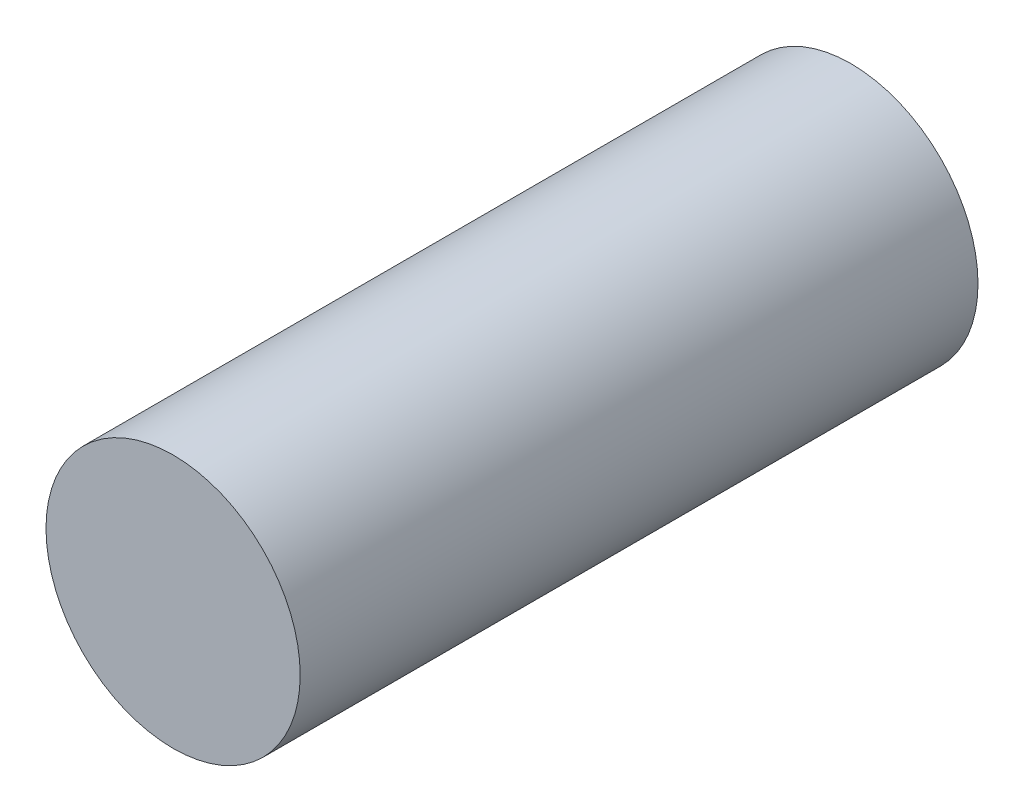
from build123d import *

# Parameters (mm, degrees)
SKETCH_1_R         = 3
SHAFT_D6_L16_DEPTH = 16


with BuildPart() as part:
    # 草图1 → Shaft_D6_L16 (new body)
    with BuildSketch(Plane.XY):
        Circle(SKETCH_1_R)
    extrude(amount=SHAFT_D6_L16_DEPTH)


solid = part.part
